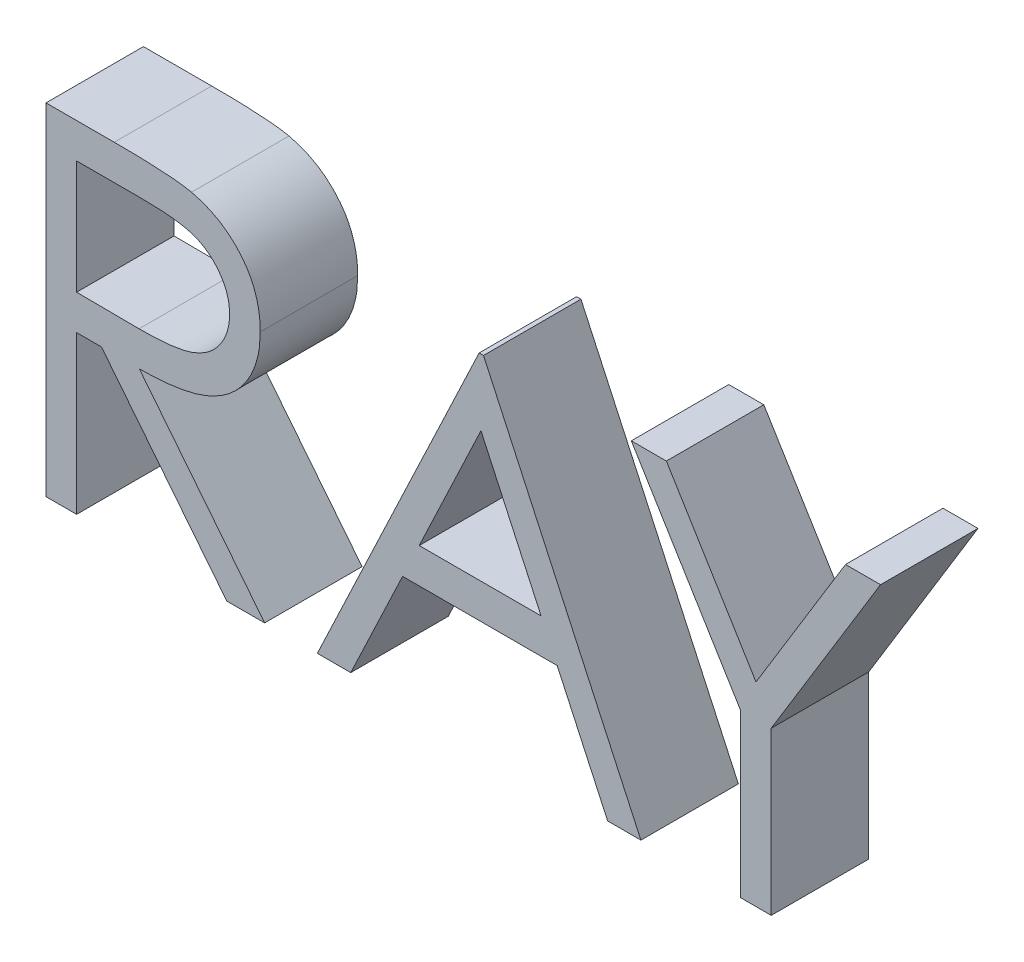
from build123d import *

# Parameters (mm, degrees)
BOSS_EXTRUDE1_DEPTH   = 1
BOSS_EXTRUDE2_DEPTH   = 1
BOSS_EXTRUDE2_2_DEPTH = 1


with BuildPart() as part:
    # Sketch1 → Boss-Extrude1 (new body)
    with BuildSketch(Plane.XY):
        with BuildLine():
            Line((0.448717949, 3.5), (1.149138622, 3.5))
            add(Edge.make_bspline(
                [(1.149138622, 3.5), (1.19587975, 3.499844414), (1.285627895, 3.499545672), (1.414201165, 3.497879909), (1.531028262, 3.493105553), (1.636048101, 3.48899697), (1.729258756, 3.481505028), (1.810946047, 3.474344381), (1.880733745, 3.46497072), (1.922979596, 3.456265297), (1.942107372, 3.452323718)],
                knots=[0, 0, 0, 0, 1.410062039, 2.707475311, 3.878576406, 4.937260626, 5.877586885, 6.699081471, 7.410979367, 8, 8, 8, 8], degree=3))
            add(Edge.make_bspline(
                [(1.942107372, 3.452323718), (1.967713996, 3.445996953), (2.018380985, 3.433478389), (2.091331051, 3.407018788), (2.160845375, 3.376399163), (2.2266352, 3.340435443), (2.288370991, 3.298860663), (2.346689302, 3.252392541), (2.401854765, 3.201285335), (2.451636395, 3.144250494), (2.498575447, 3.084413984), (2.538164073, 3.019710227), (2.572290553, 2.9520487), (2.59946107, 2.880741282), (2.621339044, 2.80647951), (2.636765283, 2.728590713), (2.646016471, 2.647429738), (2.646958326, 2.59207183), (2.647435897, 2.564002404)],
                knots=[0, 0, 0, 0, 1.027469482, 2.033020251, 3.019912614, 3.986113645, 4.951240523, 5.91722682, 6.890402269, 7.87763091, 8.8651537, 9.85103654, 10.82876324, 11.815024772, 12.821070561, 13.842952187, 14.906261191, 16, 16, 16, 16], degree=3))
            add(Edge.make_bspline(
                [(2.647435897, 2.564002404), (2.645966899, 2.517367299), (2.643100504, 2.426370131), (2.6163754, 2.29430925), (2.57259888, 2.171119935), (2.512275591, 2.056957297), (2.435456115, 1.954046652), (2.343131324, 1.863656197), (2.235249713, 1.788016284), (2.134820397, 1.735563479), (2.046106197, 1.701970571), (1.973072884, 1.678334212), (1.893405907, 1.660072247), (1.807868572, 1.643712115), (1.716104917, 1.63136042), (1.618334877, 1.622313826), (1.514488726, 1.616659777), (1.443149656, 1.615817772), (1.406450321, 1.615384615)],
                knots=[0, 0, 0, 0, 1.260483769, 2.459530307, 3.627416485, 4.787058657, 5.939039949, 7.08810263, 8.267026773, 9.491475466, 10.141966685, 10.831826277, 11.566392101, 12.351337768, 13.187381173, 14.07005841, 15.007169909, 16, 16, 16, 16], degree=3))
            Line((1.406450321, 1.615384615), (2.692307692, 0))
            Line((2.692307692, 0), (2.303886218, 0))
            Line((2.303886218, 0), (1.018028846, 1.615384615))
            Line((1.018028846, 1.615384615), (0.762820513, 1.615384615))
            Line((0.762820513, 1.615384615), (0.762820513, 0))
            Line((0.762820513, 0), (0.448717949, 0))
            Line((0.448717949, 0), (0.448717949, 3.5))
        make_face()
        with BuildLine():
            Line((0.762820513, 3.141025641), (0.762820513, 1.974358974))
            Line((0.762820513, 1.974358974), (1.403645833, 1.969451122))
            add(Edge.make_bspline(
                [(1.403645833, 1.969451122), (1.433565872, 1.969437885), (1.491559429, 1.969412229), (1.575460094, 1.973406005), (1.653580206, 1.977949323), (1.725620958, 1.984898669), (1.791614533, 1.99385474), (1.851527947, 2.005057725), (1.905458998, 2.018109787), (1.968357537, 2.038311413), (2.038594068, 2.070317431), (2.114925528, 2.11688293), (2.179927866, 2.175452049), (2.234845728, 2.242425505), (2.27897516, 2.316061754), (2.310087214, 2.395478123), (2.329829656, 2.478669721), (2.332158202, 2.535847829), (2.333333333, 2.564703526)],
                knots=[0, 0, 0, 0, 1.146690395, 2.22261258, 3.21895312, 4.145990853, 4.996080663, 5.770904154, 6.481378293, 7.121626537, 8.300444488, 9.431385265, 10.535395872, 11.636531494, 12.74115979, 13.810798291, 14.895190096, 16, 16, 16, 16], degree=3))
            add(Edge.make_bspline(
                [(2.333333333, 2.564703526), (2.332131212, 2.592850099), (2.329749047, 2.648626338), (2.310300278, 2.730282248), (2.277410897, 2.807349198), (2.233088659, 2.879513683), (2.179089504, 2.945019419), (2.115771691, 3.001066572), (2.044866496, 3.047316037), (1.978595298, 3.076870418), (1.919361085, 3.094990271), (1.867931425, 3.107741435), (1.809819948, 3.117985904), (1.744744489, 3.126193964), (1.672982858, 3.133248909), (1.594172207, 3.138000687), (1.508835427, 3.140814551), (1.449688496, 3.14095364), (1.419070513, 3.141025641)],
                knots=[0, 0, 0, 0, 1.101028733, 2.181837193, 3.264309656, 4.369019818, 5.486613113, 6.575447106, 7.666700264, 8.788928104, 9.402425223, 10.0903467, 10.862060571, 11.710948788, 12.657782767, 13.684531032, 14.801375019, 16, 16, 16, 16], degree=3))
            Line((1.419070513, 3.141025641), (0.762820513, 3.141025641))
        make_face(mode=Mode.SUBTRACT)
    extrude(amount=BOSS_EXTRUDE1_DEPTH)


with BuildPart() as body_2:
    # Sketch2 → Boss-Extrude2 (new body)
    with BuildSketch(Plane.XY.offset(1)):
        Polygon((4.938349978, 3.5), (6.553734594, 0), (6.21228828, 0), (5.694860395, 1.121794872), (4.108221773, 1.121794872), (3.576070331, 0), (3.233221773, 0), (4.893478184, 3.5), align=None)
        Polygon((4.912408472, 2.817808494), (4.278594369, 1.480769231), (5.529395651, 1.480769231), align=None, mode=Mode.SUBTRACT)
    extrude(amount=-BOSS_EXTRUDE2_DEPTH)


with BuildPart() as body_3:
    # Sketch2 → Boss-Extrude2 2 (new body)
    with BuildSketch(Plane.XY.offset(1)):
        Polygon((6.455275722, 3.5), (6.814951202, 3.5), (7.734822997, 1.99609375), (8.653292549, 3.5), (9.012968029, 3.5), (7.891173158, 1.663762019), (7.891173158, 0), (7.577070593, 0), (7.577070593, 1.663762019), align=None)
    extrude(amount=-BOSS_EXTRUDE2_2_DEPTH)


solid = Compound([part.part, body_2.part, body_3.part])
